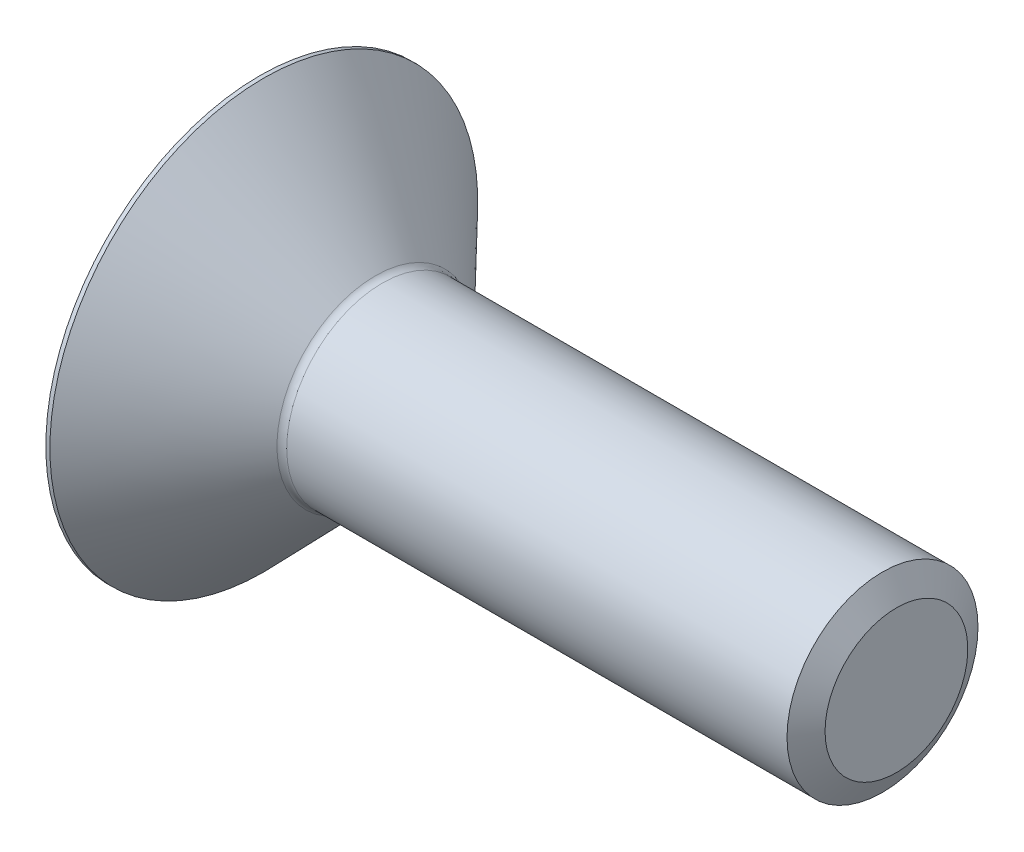
from build123d import *

# Parameters (mm, degrees)
CUT_EXTRUDE_1_DEPTH = 7.44


with BuildPart() as part:
    # 草图1 → 旋转1 (revolve)
    with BuildSketch(Plane.XY):
        with BuildLine():
            Line((0, 6), (-32.30531511, 6))
            ThreePointArc((-32.30531511, 6), (-32.539753787, 6.047697088), (-32.73691899, 6.183204978))
            Line((-32.73691899, 6.183204978), (-39.744724485, 13.44))
            Line((-39.744724485, 13.44), (-40, 13.44))
            Line((-40, 13.44), (-40, 0))
            Line((-40, 0), (0, 0))
            Line((0, 0), (0, 6))
        make_face()
    revolve(axis=Axis((0, 0, 0), (-1, 0, 0)))

    # 草图2 → 切除-拉伸1 (cut)
    with BuildSketch(Plane.ZY.offset(40)):
        Polygon((0, 4.618802154), (-4, 2.309401077), (-4, -2.309401077), (0, -4.618802154), (4, -2.309401077), (4, 2.309401077), align=None)
    extrude(amount=-CUT_EXTRUDE_1_DEPTH, mode=Mode.SUBTRACT)

    # 草图6 → 旋转2 (revolve)
    with BuildSketch(Plane.XY):
        Polygon((-35.7, 4.618802154), (-33.033333333, 0), (-31.41, 0), (-31.41, 4.618802154), align=None)
    revolve(axis=Axis((-40, 0, 0), (1, 0, 0)))

    # 草图7 → 切除-旋转2 (revolve, cut)
    with BuildSketch(Plane.XY):
        Polygon((-40, 4.618802154), (-40, 0), (-38.85, 0), align=None)
    revolve(axis=Axis((-40, 0, 0), (1, 0, 0)), mode=Mode.SUBTRACT)

    # 草图4 → 切除-旋转1 (revolve, cut)
    with BuildSketch(Plane.XY):
        Polygon((-0.875, 6), (0, 4.484455543), (0.875, 6), align=None)
    revolve(axis=Axis((-0.875, 0, 0), (1, 0, 0)), mode=Mode.SUBTRACT)


solid = part.part
